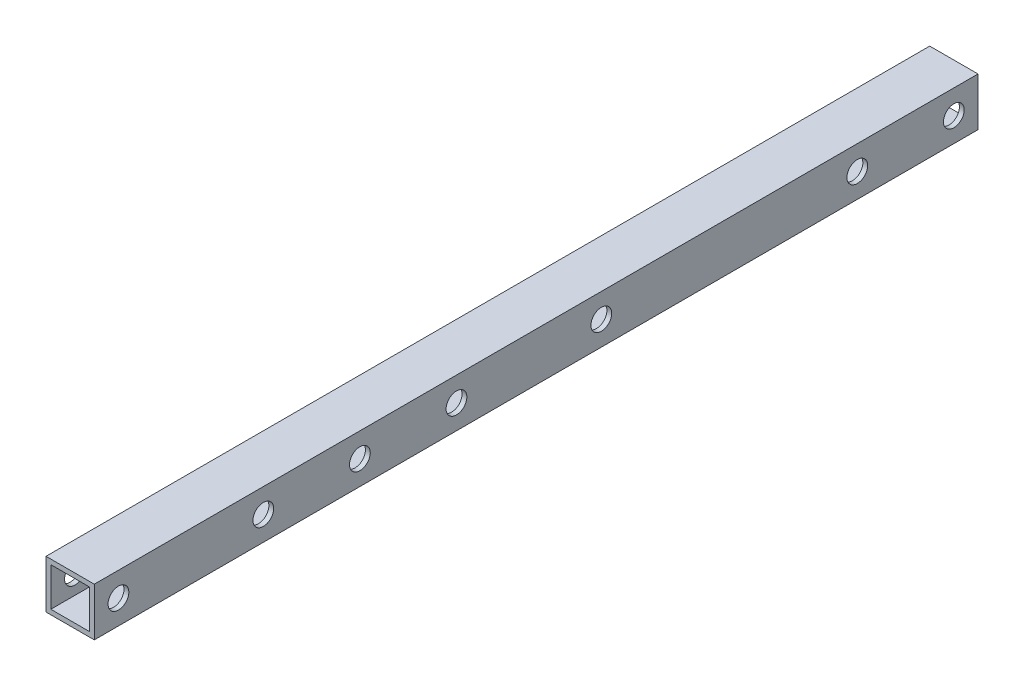
from build123d import *

# Parameters (mm, degrees)
SKETCH_1_W          = 10
SKETCH_1_H          = 10
SKETCH_1_W_2        = 8
SKETCH_1_H_2        = 8
EXTRUDE_1_DEPTH     = 183
SKETCH_2_R          = 2.15
CUT_EXTRUDE_1_DEPTH = 184.341211952


with BuildPart() as part:
    # ｽｹｯﾁ1 → 押し出し-薄板1 (new body)
    with BuildSketch(Plane.XY):
        Rectangle(SKETCH_1_W, SKETCH_1_H)
        Rectangle(SKETCH_1_W_2, SKETCH_1_H_2, mode=Mode.SUBTRACT)
    extrude(amount=EXTRUDE_1_DEPTH)

    # ｽｹｯﾁ2 → ｶｯﾄ - 押し出し1 (cut, through all)
    with BuildSketch(Plane(origin=(5, 0, 0), x_dir=(0, 0, -1), z_dir=(1, 0, 0))):
        with Locations(Location((-128, 0, 0), (0, 0, 90))):
            Circle(SKETCH_2_R)
        with Locations(Location((-108, 0, 0), (0, 0, 90))):
            Circle(SKETCH_2_R)
        with Locations(Location((-148, 0, 0), (0, 0, 90))):
            Circle(SKETCH_2_R)
        with Locations(Location((-178, 0, 0), (0, 0, 90))):
            Circle(SKETCH_2_R)
        with Locations(Location((-78, 0, 0), (0, 0, 90))):
            Circle(SKETCH_2_R)
        with Locations(Location((-5, 0, 0), (0, 0, 90))):
            Circle(SKETCH_2_R)
        with Locations(Location((-25, 0, 0), (0, 0, 90))):
            Circle(SKETCH_2_R)
    extrude(amount=-CUT_EXTRUDE_1_DEPTH, mode=Mode.SUBTRACT)


solid = part.part
